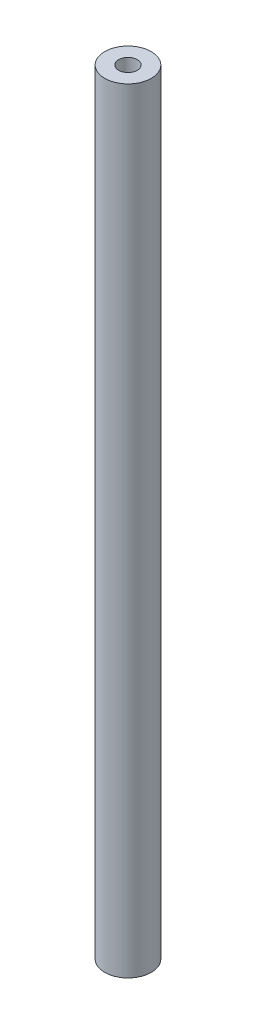
from build123d import *

# Parameters (mm, degrees)
SKETCH1_R           = 15
SKETCH1_R_2         = 6
BOSS_EXTRUDE1_DEPTH = 250
CUT_EXTRUDE1_DEPTH  = 12


with BuildPart() as part:
    # Sketch1 → Boss-Extrude1 (new, symmetric)
    with BuildSketch(Plane(origin=(0, 0, 0), x_dir=(1, 0, 0), z_dir=(0, 1, 0))):
        with Locations(Location((0, 0, 0), (0, 0, 270))):
            Circle(SKETCH1_R)
        with Locations(Location((0, 0, 0), (0, 0, 270))):
            Circle(SKETCH1_R_2, mode=Mode.SUBTRACT)
    extrude(amount=BOSS_EXTRUDE1_DEPTH, both=True)

    # Sketch2 → Cut-Extrude1 (cut)
    with BuildSketch(Plane.XY):
        with BuildLine():
            Line((-6, 200), (-6, 174.999998924))
            ThreePointArc((-6, 174.999998924), (0, 168.999998924), (6, 174.999998924))
            Line((6, 174.999998924), (6, 200))
            ThreePointArc((6, 200), (0, 206), (-6, 200))
        make_face()
    extrude(amount=-CUT_EXTRUDE1_DEPTH, mode=Mode.SUBTRACT)


solid = part.part
